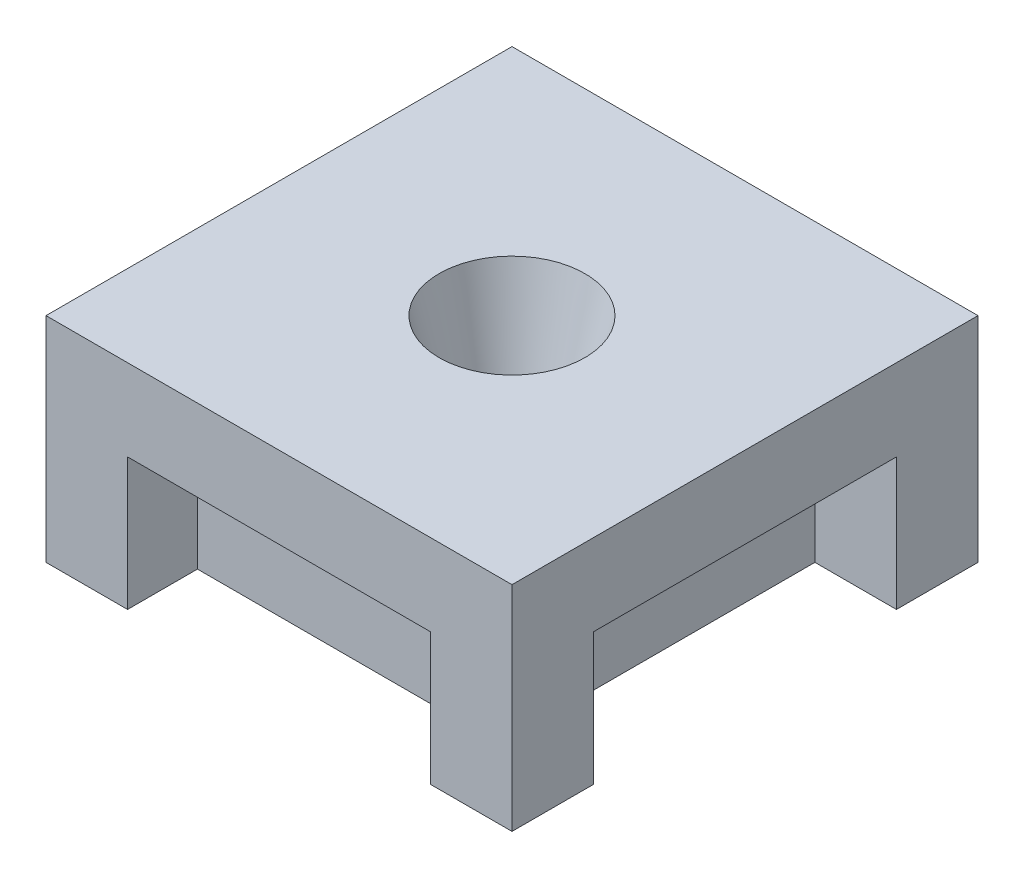
from build123d import *

# Parameters (mm, degrees)
ESBO_O1_W                  = 40
ESBO_O1_H                  = 40
RESSALTO_EXTRUS_O1_DEPTH   = 40
ESBO_O10_W                 = 26
ESBO_O10_H                 = 26
CORTE_EXTRUS_O3_DEPTH      = 7
ESBO_O11_W                 = 26
ESBO_O11_H                 = 26
CORTE_EXTRUS_O6_DEPTH      = 6
ESBO_O12_W                 = 26
ESBO_O12_H                 = 26
CORTE_EXTRUS_O7_DEPTH      = 6
ESBO_O13_W                 = 26
ESBO_O13_H                 = 26
CORTE_EXTRUS_O8_DEPTH      = 7
ESBO_O2_R                  = 6.255
ESBO_O4_R                  = 2.41
FILETE2_R                  = 0.5
CORTE_EXTRUS_O9_DEPTH      = 37
CORTE_EXTRUS_O9_DEPTH_BACK = 37
ESBO_O14_W                 = 40
ESBO_O14_H                 = 21.655550529


with BuildPart() as part:
    # Esboço1 → Ressalto-extrusão1 (new body)
    with BuildSketch(Plane(origin=(0, 0, 0), x_dir=(1, 0, 0), z_dir=(0, 1, 0))):
        with Locations((-13.703200382, -28.10068404)):
            Rectangle(ESBO_O1_W, ESBO_O1_H)
    extrude(amount=RESSALTO_EXTRUS_O1_DEPTH)

    # Esboço10 → Corte-extrusão3 (cut)
    with BuildSketch(Plane.ZY.offset(33.703200382)):
        with Locations((28.10068404, 20)):
            Rectangle(ESBO_O10_W, ESBO_O10_H)
    extrude(amount=-CORTE_EXTRUS_O3_DEPTH, mode=Mode.SUBTRACT)

    # Esboço11 → Corte-extrusão6 (cut)
    with BuildSketch(Plane(origin=(0, 0, 8.10068404), x_dir=(-1, 0, 0), z_dir=(0, 0, -1))):
        with Locations((13.703200382, 20)):
            Rectangle(ESBO_O11_W, ESBO_O11_H)
    extrude(amount=-CORTE_EXTRUS_O6_DEPTH, mode=Mode.SUBTRACT)

    # Esboço12 → Corte-extrusão7 (cut)
    with BuildSketch(Plane.XY.offset(48.10068404)):
        with Locations((-13.703200382, 20)):
            Rectangle(ESBO_O12_W, ESBO_O12_H)
    extrude(amount=-CORTE_EXTRUS_O7_DEPTH, mode=Mode.SUBTRACT)

    # Esboço13 → Corte-extrusão8 (cut)
    with BuildSketch(Plane(origin=(6.296799618, 0, 0), x_dir=(0, 0, -1), z_dir=(1, 0, 0))):
        with Locations((-28.10068404, 20)):
            Rectangle(ESBO_O13_W, ESBO_O13_H)
    extrude(amount=-CORTE_EXTRUS_O8_DEPTH, mode=Mode.SUBTRACT)

    # Esboço2 → Loft de corte2 section 0
    with BuildSketch(Plane(origin=(0, 40, 0), x_dir=(1, 0, 0), z_dir=(0, 1, 0))):
        with Locations((-13.703200382, -28.10068404)):
            Circle(ESBO_O2_R)
    # Esboço4 → Loft de corte2 section 1
    with BuildSketch(Plane(origin=(0, 24.13, 0), x_dir=(1, 0, 0), z_dir=(0, 1, 0))):
        with Locations((-13.703200382, -28.10068404)):
            Circle(ESBO_O4_R)
    loft(mode=Mode.SUBTRACT)

    # Filete2
    filete2_edges = [part.edges().sort_by_distance(p)[0] for p in [
        (-16.113200382, 24.13, 28.10068404),
    ]]
    fillet(filete2_edges, radius=FILETE2_R)

    # Esboço14 → Corte-extrusão9 (cut, two sides: drawn at the far end of the back side and taken through both)
    with BuildSketch(Plane(origin=(0, 0, 14.10068404), x_dir=(-1, 0, 0), z_dir=(0, 0, -1)).offset(-CORTE_EXTRUS_O9_DEPTH_BACK)):
        with Locations((13.703200382, 10.827775265)):
            Rectangle(ESBO_O14_W, ESBO_O14_H)
    extrude(amount=CORTE_EXTRUS_O9_DEPTH + CORTE_EXTRUS_O9_DEPTH_BACK, mode=Mode.SUBTRACT)


solid = part.part
